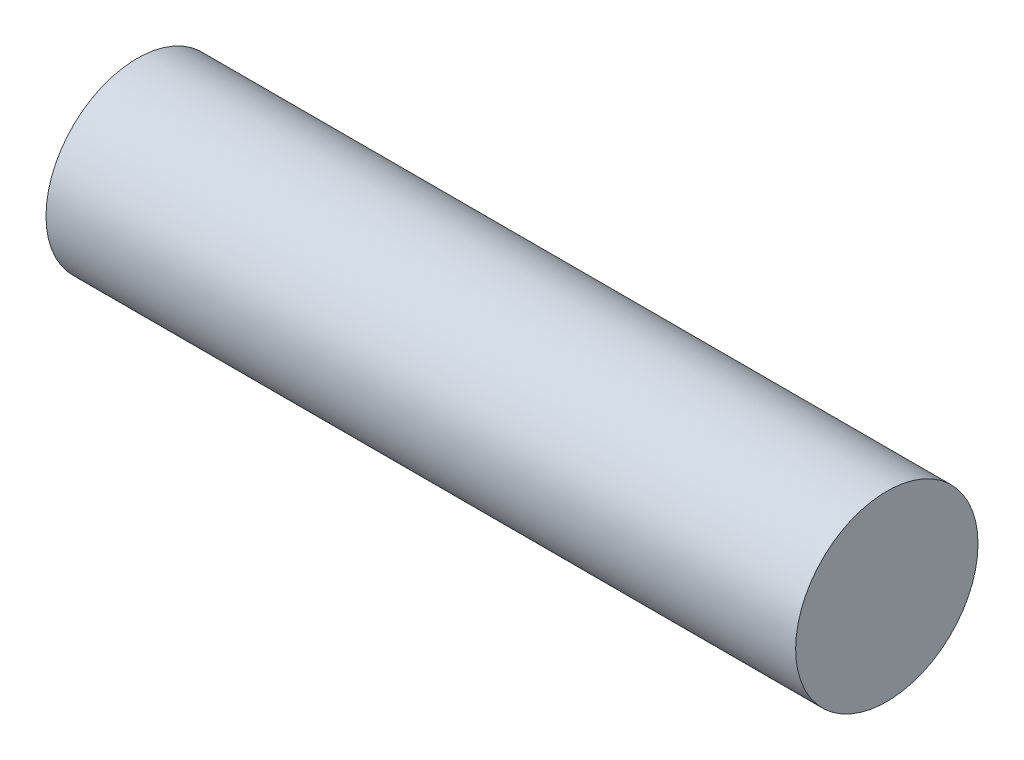
from build123d import *

# Parameters (mm, degrees)
ESQUISSE1_R        = 90
BOSS_EXTRU_1_DEPTH = 740


with BuildPart() as part:
    # Esquisse1 → Boss.-Extru.1 (new body)
    with BuildSketch(Plane(origin=(0, 0, 0), x_dir=(0, 0, -1), z_dir=(1, 0, 0))):
        Circle(ESQUISSE1_R)
    extrude(amount=BOSS_EXTRU_1_DEPTH)


solid = part.part
